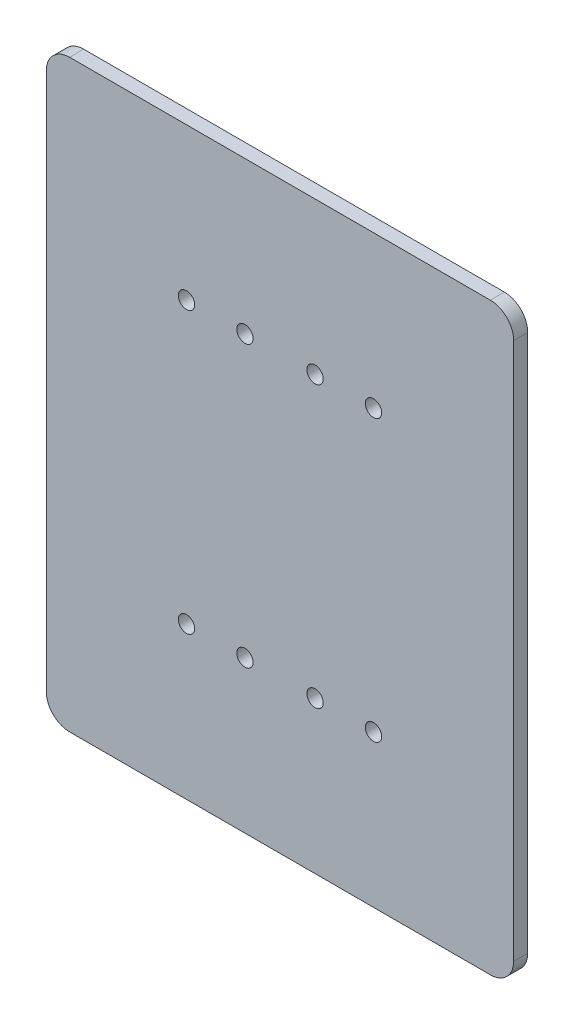
from build123d import *

# Parameters (mm, degrees)
SKETCH1_W           = 200
SKETCH1_H           = 250
BOSS_EXTRUDE1_DEPTH = 6
SKETCH2_R           = 3.5
CUT_EXTRUDE1_DEPTH  = 6
FILLET1_R           = 10


with BuildPart() as part:
    # Sketch1 → Boss-Extrude1 (new body)
    with BuildSketch(Plane.XY):
        with Locations((100, 125)):
            Rectangle(SKETCH1_W, SKETCH1_H)
    extrude(amount=BOSS_EXTRUDE1_DEPTH)

    # Sketch2 → Cut-Extrude1 (cut)
    with BuildSketch(Plane(origin=(0, 0, 0), x_dir=(-1, 0, 0), z_dir=(0, 0, -1))):
        with Locations((-60, 65)):
            Circle(SKETCH2_R)
        with Locations((-85, 65)):
            Circle(SKETCH2_R)
        with Locations((-140, 65)):
            Circle(SKETCH2_R)
        with Locations((-115, 65)):
            Circle(SKETCH2_R)
        with Locations((-140, 185)):
            Circle(SKETCH2_R)
        with Locations((-115, 185)):
            Circle(SKETCH2_R)
        with Locations((-85, 185)):
            Circle(SKETCH2_R)
        with Locations((-60, 185)):
            Circle(SKETCH2_R)
    extrude(amount=-CUT_EXTRUDE1_DEPTH, mode=Mode.SUBTRACT)

    # Fillet1
    fillet1_edges = [part.edges().sort_by_distance(p)[0] for p in [
        (0, 250, 3),
        (200, 250, 3),
        (200, 0, 3),
        (0, 0, 3),
    ]]
    fillet(fillet1_edges, radius=FILLET1_R)


solid = part.part
